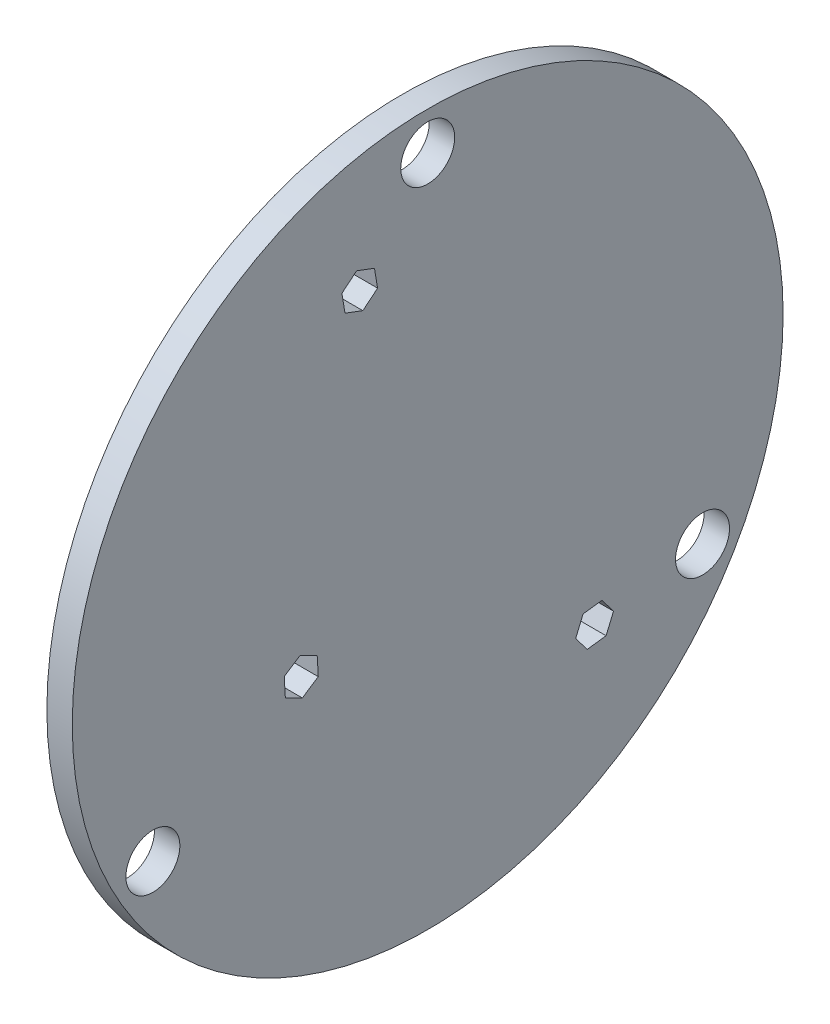
from build123d import *

# Parameters (mm, degrees)
SKETCH1_R           = 56
BOSS_EXTRUDE1_DEPTH = 4
SKETCH2_R           = 4.25
CUT_EXTRUDE1_DEPTH  = 80.296910406
CUT_EXTRUDE3_DEPTH  = 80.296910406


with BuildPart() as part:
    # Sketch1 → Boss-Extrude1 (new body)
    with BuildSketch(Plane(origin=(0, 0, 0), x_dir=(0, 0, -1), z_dir=(1, 0, 0))):
        Circle(SKETCH1_R)
    extrude(amount=BOSS_EXTRUDE1_DEPTH)

    # Sketch2 → Cut-Extrude1 (cut, through all)
    with BuildSketch(Plane.ZY):
        with Locations((0, 50)):
            Circle(SKETCH2_R)
        with Locations((43.301270189, -25)):
            Circle(SKETCH2_R)
        with Locations((-43.301270189, -25)):
            Circle(SKETCH2_R)
    extrude(amount=-CUT_EXTRUDE1_DEPTH, mode=Mode.SUBTRACT)

    # Sketch4 → Cut-Extrude3 (cut, through all)
    with BuildSketch(Plane(origin=(4, 0, 0), x_dir=(0, 0, -1), z_dir=(1, 0, 0))):
        Polygon((27.459399078, -24.776044357), (24.480611991, -25.150424944), (23.315441547, -27.917320527), (25.12905819, -30.309835523), (28.107845277, -29.935454936), (29.273015721, -27.168559353), align=None)
        Polygon((-13.023850584, 34.635102926), (-10.212575655, 33.581505942), (-7.894496437, 35.489342956), (-8.387692148, 38.450776954), (-11.198967077, 39.504373938), (-13.517046295, 37.596536924), align=None)
        Polygon((-17.236572945, -12.849128791), (-17.40919881, -9.85187444), (-20.091210152, -8.502745649), (-22.600595629, -10.150871209), (-22.427969764, -13.14812556), (-19.745958422, -14.497254351), align=None)
    extrude(amount=-CUT_EXTRUDE3_DEPTH, mode=Mode.SUBTRACT)


solid = part.part
